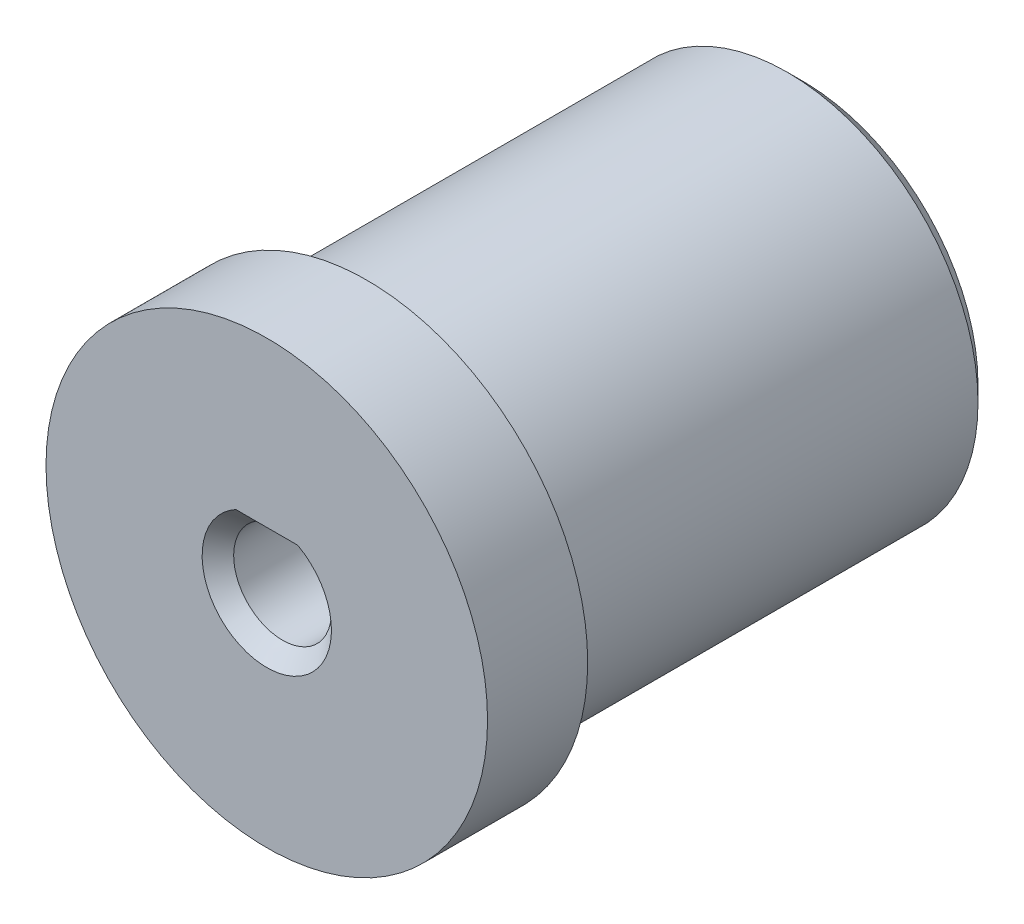
from build123d import *

# Parameters (mm, degrees)
SKETCH2_R           = 12.1
BOSS_EXTRUDE1_DEPTH = 34
BOSS_EXTRUDE2_START = -6.35
SKETCH3_R           = 14
SKETCH3_R_2         = 12.1
BOSS_EXTRUDE2_DEPTH = 6.35
CHAMFER1_SIZE       = 1


with BuildPart() as part:
    # Sketch2 → Boss-Extrude1 (new body)
    with BuildSketch(Plane.XY):
        Circle(SKETCH2_R)
        with BuildLine():
            Line((-1.688194302, 2.6), (1.688194302, 2.6))
            ThreePointArc((1.688194302, 2.6), (0, -3.1), (-1.688194302, 2.6))
        make_face(mode=Mode.SUBTRACT)
    extrude(amount=BOSS_EXTRUDE1_DEPTH)

    # Sketch3 → Boss-Extrude2 (add)
    # profile 1 of 2: a face of its own
    with BuildSketch(Plane.XY.offset(34).offset(BOSS_EXTRUDE2_START)):
        Circle(SKETCH3_R)
        Circle(SKETCH3_R_2, mode=Mode.SUBTRACT)
    # profile 2 of 2: a face of its own
    with BuildSketch(Plane.XY.offset(34).offset(BOSS_EXTRUDE2_START)):
        Circle(SKETCH3_R_2)
        with BuildLine():
            Line((-1.688194302, 2.6), (1.688194302, 2.6))
            ThreePointArc((1.688194302, 2.6), (0, -3.1), (-1.688194302, 2.6))
        make_face(mode=Mode.SUBTRACT)
    extrude(amount=BOSS_EXTRUDE2_DEPTH)

    # Chamfer1
    chamfer1_edges = [part.edges().sort_by_distance(p)[0] for p in [
        (0, 2.6, 34),
        (-12.1, 0, 0),
        (0, 2.6, 0),
        (0, -3.1, 0),
        (0, -3.1, 34),
    ]]
    chamfer(chamfer1_edges, length=CHAMFER1_SIZE)


solid = part.part
